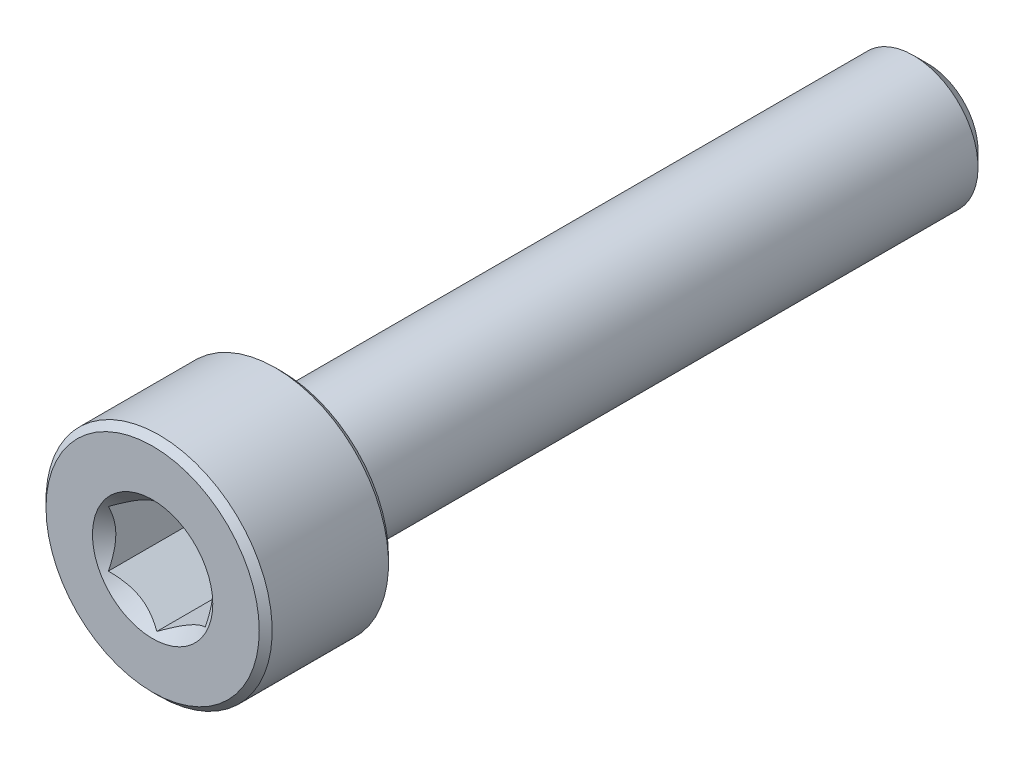
from build123d import *

# Parameters (mm, degrees)
CUT_EXTRUDE1_DEPTH = 3


with BuildPart() as part:
    # Sketch2 → Revolve1 (revolve)
    with BuildSketch(Plane(origin=(0, 0, 0), x_dir=(0, 0, -1), z_dir=(1, 0, 0))):
        with BuildLine():
            Line((-12, 0), (-12, 3.3))
            Line((-12, 3.3), (-11.8, 3.5))
            Line((-11.8, 3.5), (-8.2, 3.5))
            Line((-8.2, 3.5), (-8, 3.3))
            Line((-8, 3.3), (-8, 2.2))
            ThreePointArc((-8, 2.2), (-7.941421356, 2.058578644), (-7.8, 2))
            Line((-7.8, 2), (11.545336663, 2))
            Line((11.545336663, 2), (12, 1.545336663))
            Line((12, 1.545336663), (12, 0))
            Line((12, 0), (-12, 0))
        make_face()
    revolve(axis=Axis((0, 0, -12), (0, 0, 1)))

    # Sketch3 → Cut-Extrude1 (cut)
    with BuildSketch(Plane.XY.offset(12)):
        Polygon((1.5, -0.866025404), (1.5, 0.866025404), (0, 1.732050808), (-1.5, 0.866025404), (-1.5, -0.866025404), (0, -1.732050808), align=None)
    extrude(amount=-CUT_EXTRUDE1_DEPTH, mode=Mode.SUBTRACT)

    # Cut-Extrude2 cone 1 section (through the dimple's axis) → Cut-Extrude2 (revolve, cut)
    with BuildSketch(Plane(origin=(0, 0, 12), x_dir=(0, -1, 0), z_dir=(1, 0, 0))):
        Polygon((0, 0), (1.861954618, 0), (0, 1.861954618), align=None)
    revolve(axis=Axis((0, 0, 12), (0, 0, -1)), mode=Mode.SUBTRACT)


solid = part.part
